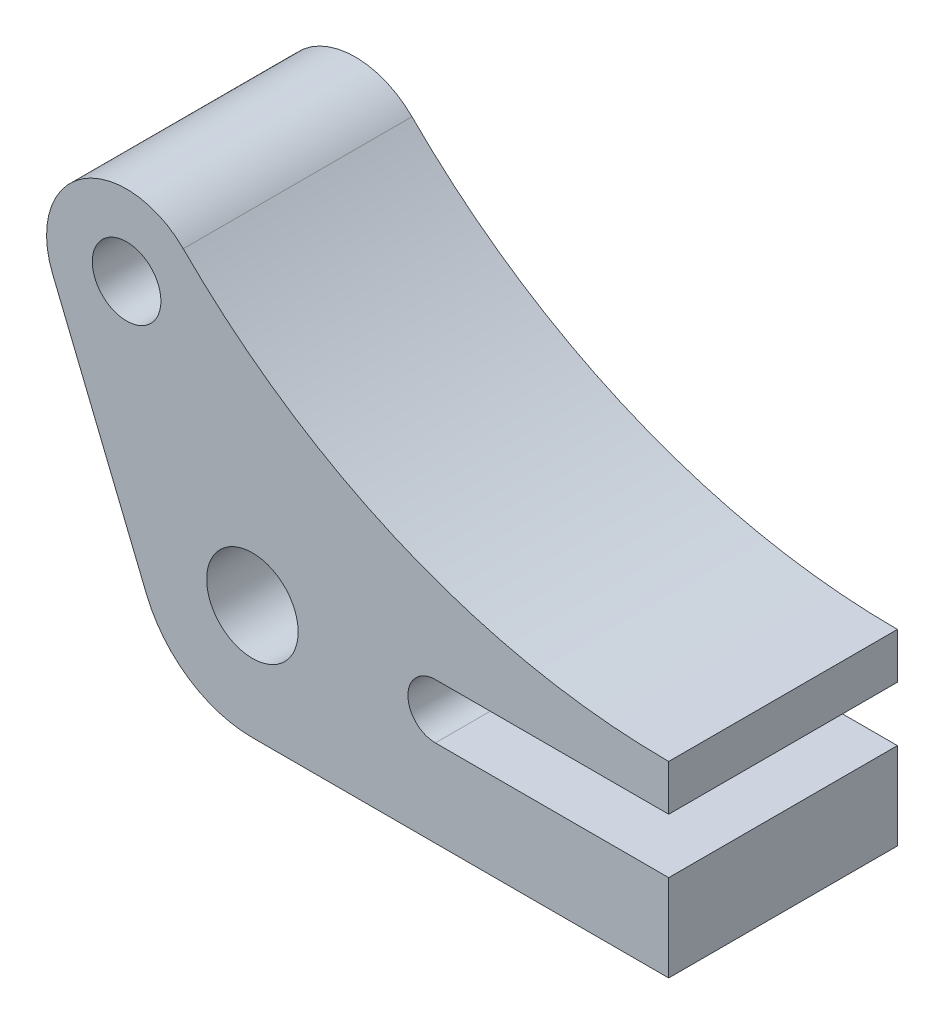
from build123d import *

# Parameters (mm, degrees)
SKETCH1_R           = 7.5
SKETCH1_R_2         = 10
BOSS_EXTRUDE1_DEPTH = 25


with BuildPart() as part:
    # Sketch1 → Boss-Extrude1 (new, symmetric)
    with BuildSketch(Plane.XY):
        with BuildLine():
            ThreePointArc((40, 6), (34, 0), (40, -6))
            Line((40, -6), (91.012125426, -6))
            Line((91.012125426, -6), (91.012125426, -25))
            Line((91.012125426, -25), (0, -25))
            ThreePointArc((0, -25), (-13.950413836, -20.745745439), (-23.152938737, -9.430876304))
            Line((-23.152938737, -9.430876304), (-43.707057116, 41.029783795))
            ThreePointArc((-43.707057116, 41.029783795), (-37.175167009, 62.213617319), (-15.118136149, 59.998266157))
            ThreePointArc((-15.118136149, 59.998266157), (33.56763081, 27.43546616), (91.012125426, 16))
            Line((91.012125426, 16), (91.012125426, 6))
            Line((91.012125426, 6), (40, 6))
        make_face()
        with Locations((-27.5, 47.631397208)):
            Circle(SKETCH1_R, mode=Mode.SUBTRACT)
        Circle(SKETCH1_R_2, mode=Mode.SUBTRACT)
    extrude(amount=BOSS_EXTRUDE1_DEPTH, both=True)


solid = part.part
